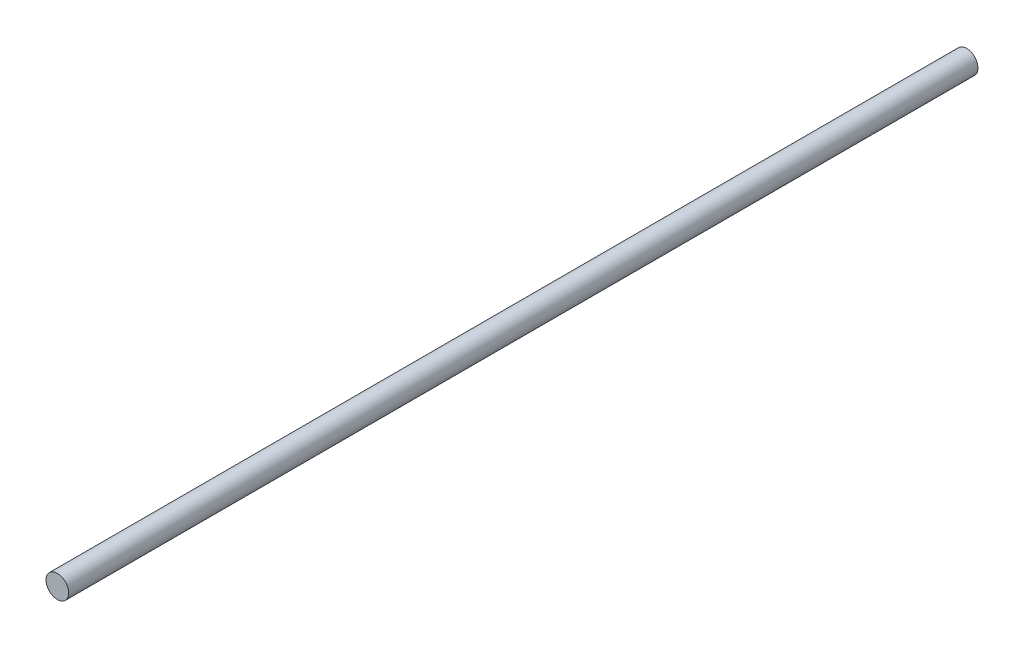
from build123d import *

# Parameters (mm, degrees)
ESQUISSE1_R        = 5
BOSS_EXTRU_1_DEPTH = 400


with BuildPart() as part:
    # Esquisse1 → Boss.-Extru.1 (new body)
    with BuildSketch(Plane.XY):
        Circle(ESQUISSE1_R)
    extrude(amount=BOSS_EXTRU_1_DEPTH)


solid = part.part
